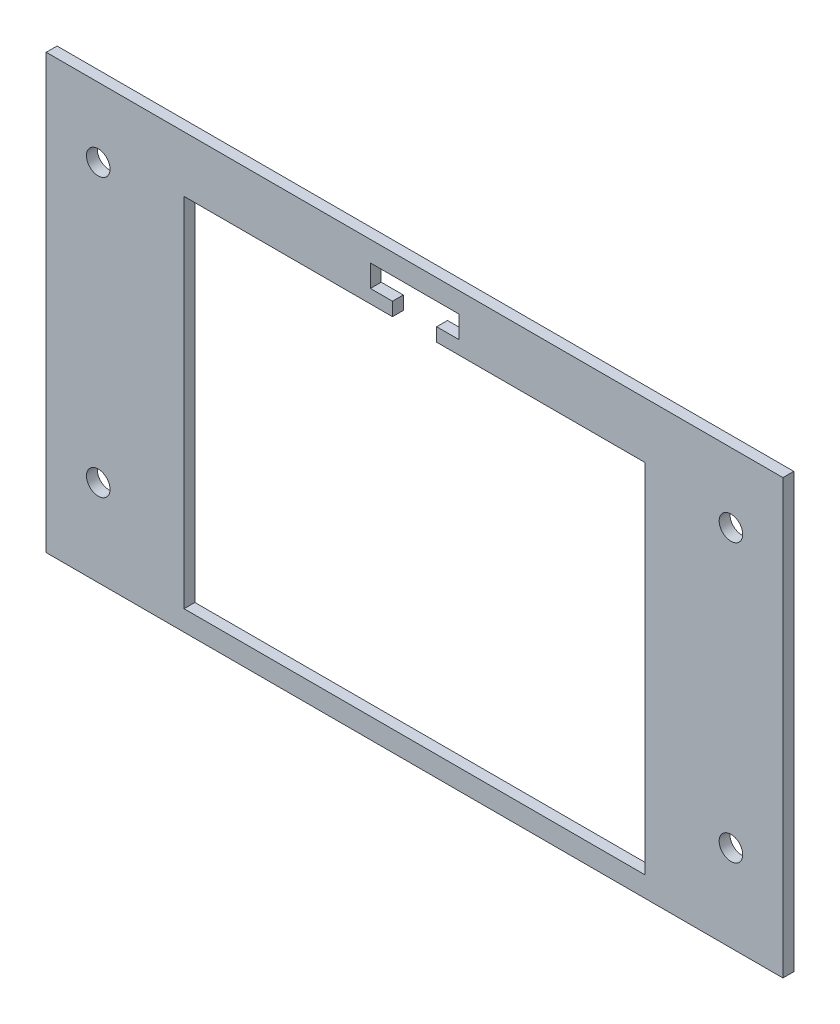
from build123d import *

# Parameters (mm, degrees)
SKETCH1_W             = 107.95
SKETCH1_H             = 63.5
BOSS_EXTRUDE1_DEPTH   = 1.5875
CUT_EXTRUDE1_DEPTH    = 63.640907411
F_4_CLEARANCE_HOLE1_D = 3.4544


with BuildPart() as part:
    # Sketch1 → Boss-Extrude1 (new body)
    with BuildSketch(Plane.XY):
        Rectangle(SKETCH1_W, SKETCH1_H)
    extrude(amount=BOSS_EXTRUDE1_DEPTH)

    # Sketch2 → Cut-Extrude1 (cut, through all)
    with BuildSketch(Plane.XY.offset(1.5875)):
        Polygon((-3.2385, 25.527), (-3.2385, 23.5585), (-33.782, 23.5585), (-33.782, -28.7655), (33.782, -28.7655), (33.782, 23.5585), (3.2385, 23.5585), (3.2385, 25.527), (6.477, 25.527), (6.477, 28.7655), (-6.477, 28.7655), (-6.477, 25.527), align=None)
    extrude(amount=-CUT_EXTRUDE1_DEPTH, mode=Mode.SUBTRACT)

    # #4 Clearance Hole1 (through all)
    with Locations(Plane.XY.offset(1.5875)):
        with Locations((-46.355, 21.59), (-46.355, -19.05), (46.355, 21.59), (46.355, -19.05)):
            Hole(F_4_CLEARANCE_HOLE1_D / 2)


solid = part.part
